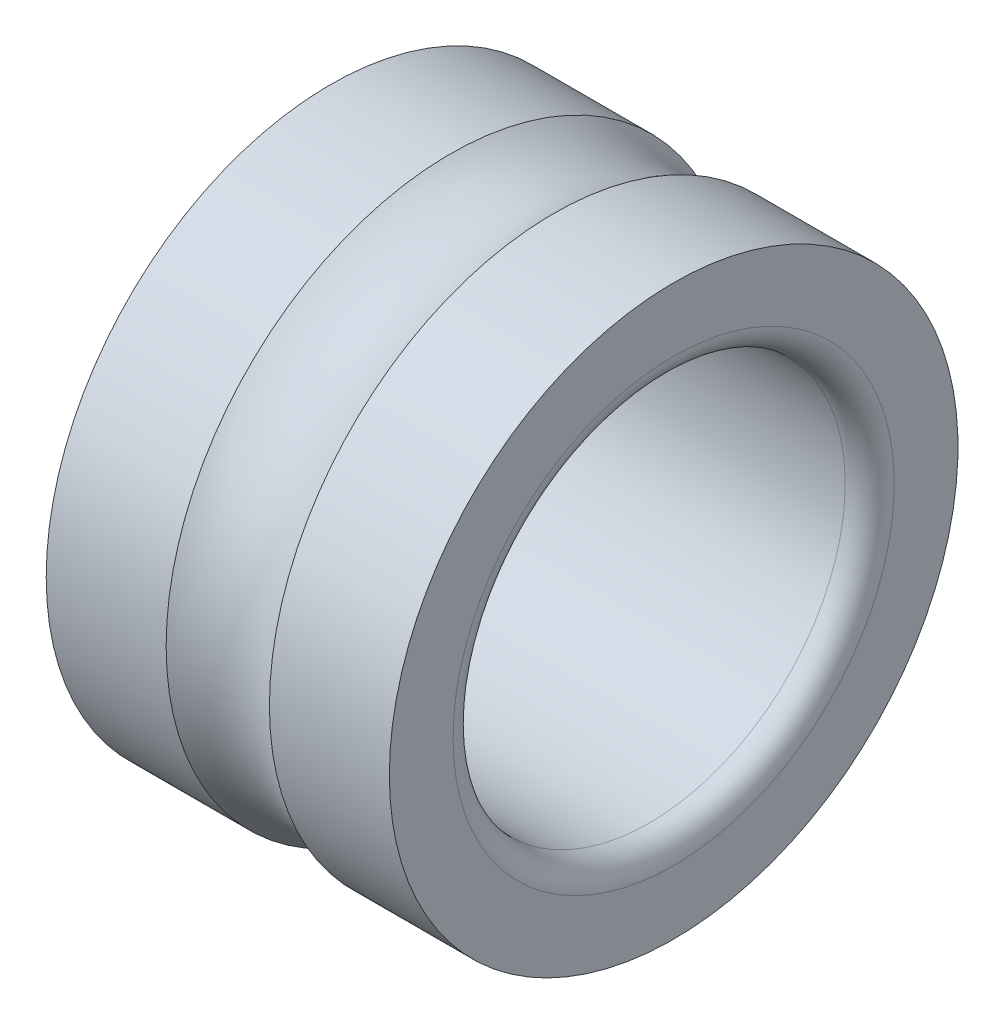
from build123d import *


with BuildPart() as part:
    # Esquisse1 → Base-Révolution (revolve)
    with BuildSketch(Plane.XY, mode=Mode.PRIVATE) as base_r_volution_sk:
        with BuildLine():
            Line((3.5, 4.5), (3.5, 5.8))
            Line((3.5, 5.8), (1.053565375, 5.8))
            ThreePointArc((1.053565375, 5.8), (0, 5.5), (-1.053565375, 5.8))
            Line((-1.053565375, 5.8), (-3.5, 5.8))
            Line((-3.5, 5.8), (-3.5, 4.5))
            ThreePointArc((-3.5, 4.5), (-3.353553391, 4.146446609), (-3, 4))
            Line((-3, 4), (3, 4))
            ThreePointArc((3, 4), (3.353553391, 4.146446609), (3.5, 4.5))
        make_face()
    revolve(base_r_volution_sk.sketch.rotate(Axis((-4.370908092, 0, 0), (1, 0, 0)), 90), axis=Axis((-4.370908092, 0, 0), (1, 0, 0)))


solid = part.part
